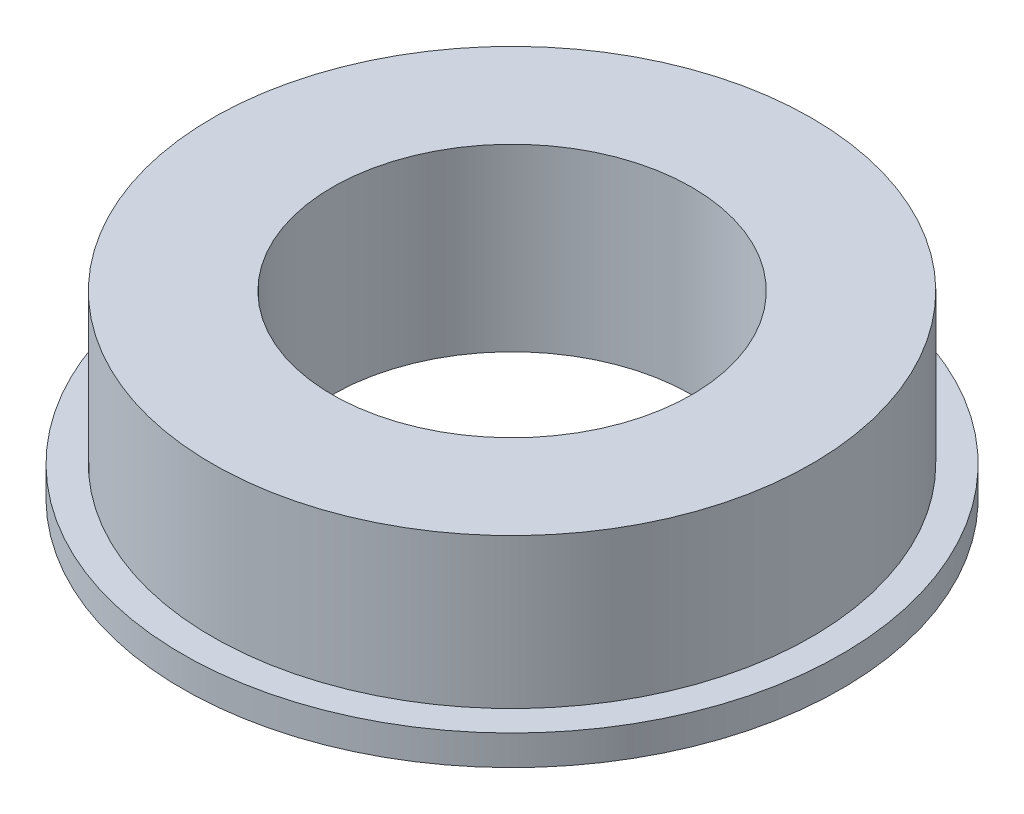
from build123d import *

# Parameters (mm, degrees)
SKETCH_1_W = 0.5
SKETCH_1_H = 0.5


with BuildPart() as part:
    # 草图1 → 旋转1 (revolve)
    with BuildSketch(Plane.XY, mode=Mode.PRIVATE) as revolve_1_sk:
        Polygon((5, 3), (3, 3), (3, 0), (5, 0), (5, 0.5), align=None)
        with Locations((5.25, 0.25)):
            Rectangle(SKETCH_1_W, SKETCH_1_H)
    revolve(revolve_1_sk.sketch.rotate(Axis((0, 0, 0), (0, 1, 0)), 90), axis=Axis((0, 0, 0), (0, 1, 0)))


solid = part.part
